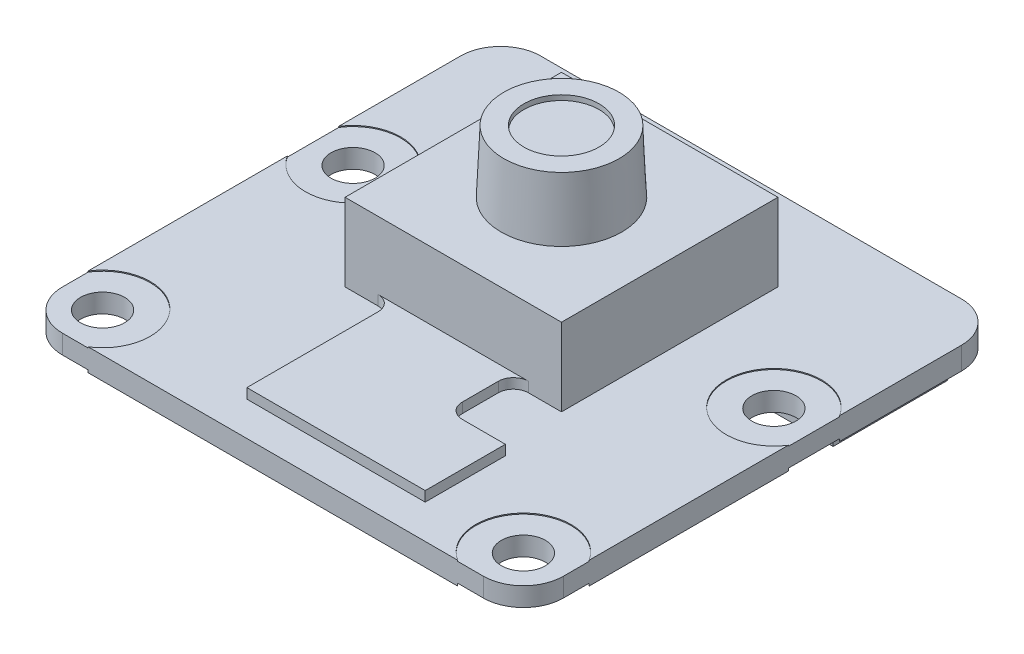
from build123d import *

# Parameters (mm, degrees)
SKETCH1_W           = 25
SKETCH1_H           = 23.862
SKETCH1_R           = 1.1
BOSS_EXTRUDE1_DEPTH = 1.12
FILLET1_R           = 2
SKETCH2_R           = 2.375
CUT_EXTRUDE1_DEPTH  = 0.05
CUT_EXTRUDE2_START  = -0.995
SKETCH2_3_R         = 2.375
CUT_EXTRUDE2_DEPTH  = 0.125
SKETCH3_W           = 10.8
SKETCH3_H           = 10.8
BOSS_EXTRUDE2_DEPTH = 3.875
BOSS_EXTRUDE3_START = 3.875
SKETCH3_3_R         = 2.875
BOSS_EXTRUDE3_DEPTH = 3.105
SKETCH5_R           = 1.875
CUT_EXTRUDE3_DEPTH  = 0.25
DRAFT1_ANGLE        = 2.5
SKETCH6_W           = 6
SKETCH6_H           = 3.3
SKETCH6_H_2         = 4
SKETCH6_W_2         = 2.9
BOSS_EXTRUDE4_DEPTH = 0.5
FILLET2_R           = 0.75
SKETCH7_W           = 19.61
SKETCH7_H           = 5.71
BOSS_EXTRUDE5_DEPTH = 2.75
SKETCH8_W           = 18.61
SKETCH8_H           = 1.75
CUT_EXTRUDE4_DEPTH  = 5.21


with BuildPart() as part:
    # Sketch1 → Boss-Extrude1 (new body)
    with BuildSketch(Plane(origin=(0, 0, 0), x_dir=(1, 0, 0), z_dir=(0, 1, 0))):
        with Locations((0, -2.469)):
            Rectangle(SKETCH1_W, SKETCH1_H)
        with Locations(Location((-10.5, -12.4, 0), (0, 0, 270))):
            Circle(SKETCH1_R, mode=Mode.SUBTRACT)
        with Locations(Location((-10.5, 0.1, 0), (0, 0, 270))):
            Circle(SKETCH1_R, mode=Mode.SUBTRACT)
        with Locations(Location((10.5, -12.4, 0), (0, 0, 90))):
            Circle(SKETCH1_R, mode=Mode.SUBTRACT)
        with Locations(Location((10.5, 0.1, 0), (0, 0, 90))):
            Circle(SKETCH1_R, mode=Mode.SUBTRACT)
    extrude(amount=BOSS_EXTRUDE1_DEPTH)

    # Fillet1
    fillet1_edges = [part.edges().sort_by_distance(p)[0] for p in [
        (12.5, 0.56, 14.4),
        (-12.5, 0.56, 14.4),
        (-12.5, 0.56, -9.462),
        (12.5, 0.56, -9.462),
    ]]
    fillet(fillet1_edges, radius=FILLET1_R)

    # Sketch2 → Cut-Extrude1 (cut)
    with BuildSketch(Plane(origin=(0, 1.12, 0), x_dir=(1, 0, 0), z_dir=(0, 1, 0))):
        with Locations((-10.5, -12.4)):
            Circle(SKETCH2_R)
        with Locations((-10.5, 0.1)):
            Circle(SKETCH2_R)
        with Locations((10.5, -12.4)):
            Circle(SKETCH2_R)
        with Locations((10.5, 0.1)):
            Circle(SKETCH2_R)
    extrude(amount=-CUT_EXTRUDE1_DEPTH, mode=Mode.SUBTRACT)

    # Sketch2<3> → Cut-Extrude2 (cut)
    with BuildSketch(Plane(origin=(0, 1.12, 0), x_dir=(1, 0, 0), z_dir=(0, 1, 0)).offset(CUT_EXTRUDE2_START)):
        with Locations((-10.5, -12.4)):
            Circle(SKETCH2_3_R)
        with Locations((-10.5, 0.1)):
            Circle(SKETCH2_3_R)
        with Locations((10.5, -12.4)):
            Circle(SKETCH2_3_R)
        with Locations((10.5, 0.1)):
            Circle(SKETCH2_3_R)
    extrude(amount=-CUT_EXTRUDE2_DEPTH, mode=Mode.SUBTRACT)


with BuildPart() as body_2:
    # Sketch3 → Boss-Extrude2 (new body)
    with BuildSketch(Plane(origin=(0, 1.12, 0), x_dir=(1, 0, 0), z_dir=(0, 1, 0))):
        Rectangle(SKETCH3_W, SKETCH3_H)
    extrude(amount=BOSS_EXTRUDE2_DEPTH)

    # Sketch3<3> → Boss-Extrude3 (add)
    with BuildSketch(Plane(origin=(0, 1.12, 0), x_dir=(1, 0, 0), z_dir=(0, 1, 0)).offset(BOSS_EXTRUDE3_START)):
        with Locations(Location((0, 0, 0), (0, 0, 270))):
            Circle(SKETCH3_3_R)
    extrude(amount=BOSS_EXTRUDE3_DEPTH)

    # Sketch5 → Cut-Extrude3 (cut)
    with BuildSketch(Plane(origin=(0, 8.1, 0), x_dir=(1, 0, 0), z_dir=(0, 1, 0))):
        with Locations(Location((0, 0, 0), (0, 0, 270))):
            Circle(SKETCH5_R)
    extrude(amount=-CUT_EXTRUDE3_DEPTH, mode=Mode.SUBTRACT)

    # Draft1
    draft1_faces = [body_2.faces().sort_by_distance(p)[0] for p in [
        (0, 6.5475, -2.875),
    ]]
    draft(draft1_faces, Plane.ZX.offset(8.1), DRAFT1_ANGLE)

    # Sketch6 → Boss-Extrude4 (add)
    with BuildSketch(Plane(origin=(0, 1.12, 0), x_dir=(1, 0, 0), z_dir=(0, 1, 0))):
        with Locations((0, -7.05)):
            Rectangle(SKETCH6_W, SKETCH6_H)
        with Locations((0, -10.7)):
            Rectangle(SKETCH6_W, SKETCH6_H_2)
        with Locations((4.45, -10.7)):
            Rectangle(SKETCH6_W_2, SKETCH6_H_2)
    extrude(amount=BOSS_EXTRUDE4_DEPTH)

    # Fillet2
    fillet2_edges = [body_2.edges().sort_by_distance(p)[0] for p in [
        (-3, 1.37, 5.4),
        (3, 1.37, 8.7),
        (3, 1.37, 5.4),
    ]]
    fillet(fillet2_edges, radius=FILLET2_R)


with BuildPart() as body_3:
    # Sketch7 → Boss-Extrude5 (new body)
    with BuildSketch(Plane.XZ):
        with Locations((0, -6.607)):
            Rectangle(SKETCH7_W, SKETCH7_H)
    extrude(amount=BOSS_EXTRUDE5_DEPTH)

    # Sketch8 → Cut-Extrude4 (cut)
    with BuildSketch(Plane(origin=(0, 0, -9.462), x_dir=(-1, 0, 0), z_dir=(0, 0, -1))):
        with Locations((0, -1.375)):
            Rectangle(SKETCH8_W, SKETCH8_H)
    extrude(amount=-CUT_EXTRUDE4_DEPTH, mode=Mode.SUBTRACT)


solid = Compound([part.part, body_2.part, body_3.part])
